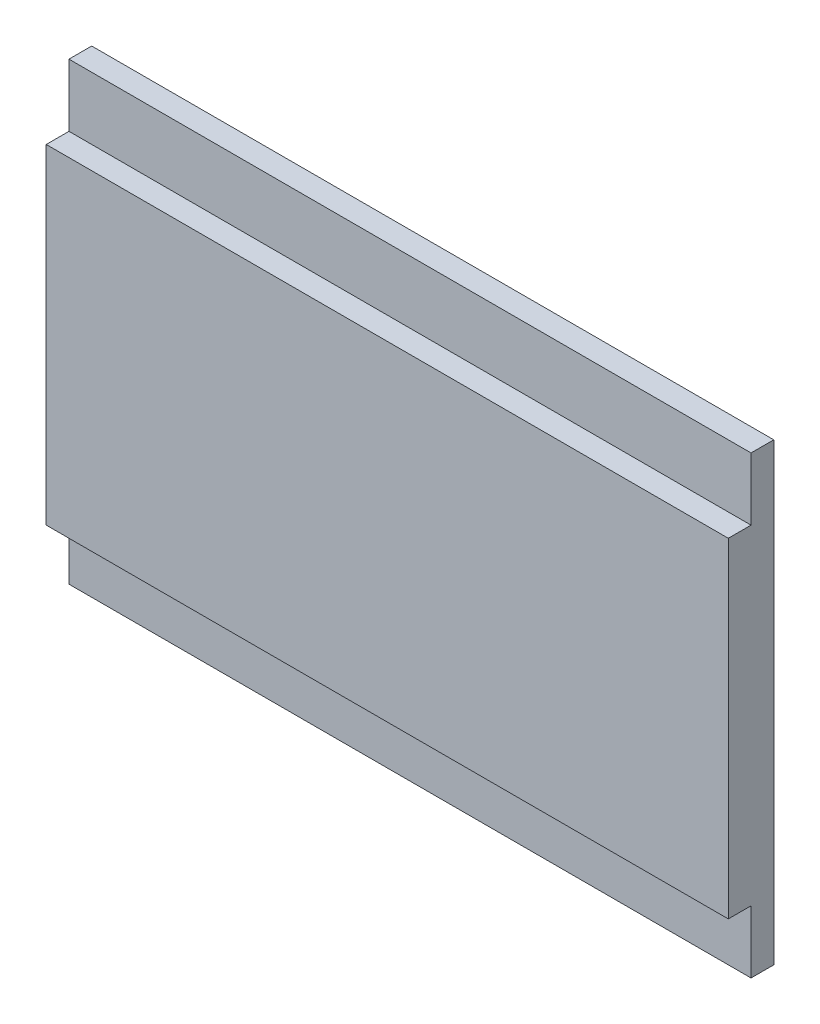
from build123d import *

# Parameters (mm, degrees)
SKETCH1_W           = 300
SKETCH1_H           = 200
BOSS_EXTRUDE1_DEPTH = 10
SKETCH1_3_W         = 300
SKETCH1_3_H         = 145
BOSS_EXTRUDE2_DEPTH = 20


with BuildPart() as part:
    # Sketch1 → Boss-Extrude1 (new body)
    with BuildSketch(Plane.XY):
        with Locations((150, 100)):
            Rectangle(SKETCH1_W, SKETCH1_H)
    extrude(amount=BOSS_EXTRUDE1_DEPTH)

    # Sketch1<3> → Boss-Extrude2 (add)
    with BuildSketch(Plane.XY):
        with Locations((150, 100)):
            Rectangle(SKETCH1_3_W, SKETCH1_3_H)
    extrude(amount=BOSS_EXTRUDE2_DEPTH)


solid = part.part
